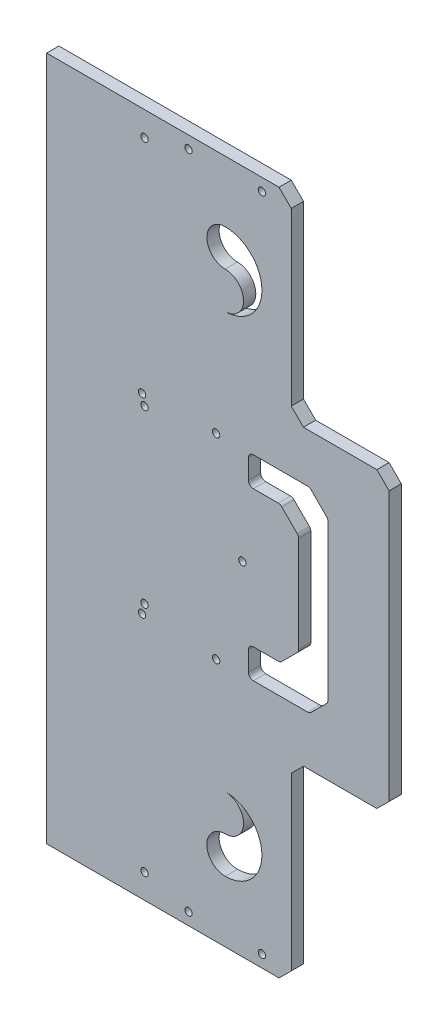
from build123d import *

# Parameters (mm, degrees)
SKETCH_1_R          = 1.5
EXTRUDE_1_DEPTH     = 5
CHAMFER_1_SIZE      = 5
SKETCH_3_R          = 1.5
CUT_EXTRUDE_2_DEPTH = 10
FILLET_1_R          = 10
FILLET_2_R          = 2
CUT_EXTRUDE_3_DEPTH = 199.053023203
EXTRUDE_2_DEPTH     = 5


with BuildPart() as part:
    # 草图1 → 凸台-拉伸1 (new body)
    with BuildSketch(Plane.XY):
        Polygon((-100, -140), (-100, -60), (-140, -60), (-140, 60), (-100, 60), (-100, 140), (100, 140), (100, 60), (140, 60), (140, -60), (100, -60), (100, -140), align=None)
        with Locations((-40, -130)):
            Circle(SKETCH_1_R, mode=Mode.SUBTRACT)
        with Locations((-40, -35)):
            Circle(SKETCH_1_R, mode=Mode.SUBTRACT)
        with Locations(Location((40, -130, 0), (0, 0, 180))):
            Circle(SKETCH_1_R, mode=Mode.SUBTRACT)
        with Locations(Location((40, -35, 0), (0, 0, 180))):
            Circle(SKETCH_1_R, mode=Mode.SUBTRACT)
        with Locations(Location((-40, 130, 0), (0, 0, 180))):
            Circle(SKETCH_1_R, mode=Mode.SUBTRACT)
        with Locations((40, 130)):
            Circle(SKETCH_1_R, mode=Mode.SUBTRACT)
        with Locations((40, 35)):
            Circle(SKETCH_1_R, mode=Mode.SUBTRACT)
        with Locations(Location((-40, 35, 0), (0, 0, 180))):
            Circle(SKETCH_1_R, mode=Mode.SUBTRACT)
        with Locations((-39, 39)):
            Circle(SKETCH_1_R, mode=Mode.SUBTRACT)
        with Locations((39, 39)):
            Circle(SKETCH_1_R, mode=Mode.SUBTRACT)
        with Locations((39, -39)):
            Circle(SKETCH_1_R, mode=Mode.SUBTRACT)
        with Locations((-39, -39)):
            Circle(SKETCH_1_R, mode=Mode.SUBTRACT)
    extrude(amount=EXTRUDE_1_DEPTH)

    # 倒角1
    chamfer_1_edges = [part.edges().sort_by_distance(p)[0] for p in [
        (-100, -140, 2.5),
        (-100, -60, 2.5),
        (-140, -60, 2.5),
        (-140, 60, 2.5),
        (-100, 60, 2.5),
        (-100, 140, 2.5),
        (100, 140, 2.5),
        (100, 60, 2.5),
        (140, 60, 2.5),
        (140, -60, 2.5),
        (100, -60, 2.5),
        (100, -140, 2.5),
    ]]
    chamfer(chamfer_1_edges, length=CHAMFER_1_SIZE)

    # 草图3 → 切除-拉伸2 (cut)
    with BuildSketch(Plane.XY.offset(5)):
        with Locations((-88, 135)):
            Circle(SKETCH_3_R)
        with Locations((-58, 135)):
            Circle(SKETCH_3_R)
        with Locations((58, 135)):
            Circle(SKETCH_3_R)
        with Locations((88, 135)):
            Circle(SKETCH_3_R)
        with Locations((88, -135)):
            Circle(SKETCH_3_R)
        with Locations((58, -135)):
            Circle(SKETCH_3_R)
        with Locations((-58, -135)):
            Circle(SKETCH_3_R)
        with Locations((-88, -135)):
            Circle(SKETCH_3_R)
        with Locations((-80, 0)):
            Circle(SKETCH_3_R)
        with Locations((-69.282032303, 40)):
            Circle(SKETCH_3_R)
        with Locations((69.282032303, 40)):
            Circle(SKETCH_3_R)
        with Locations((80, 0)):
            Circle(SKETCH_3_R)
        with Locations((69.282032303, -40)):
            Circle(SKETCH_3_R)
        with Locations((-69.282032303, -40)):
            Circle(SKETCH_3_R)
        with BuildLine():
            Line((-25, -35), (25, -35))
            ThreePointArc((25, -35), (29.393398282, -45.606601718), (40, -50))
            Line((40, -50), (40, -115))
            ThreePointArc((40, -115), (29.393398282, -119.393398282), (25, -130))
            Line((25, -130), (-25, -130))
            ThreePointArc((-25, -130), (-29.393398282, -119.393398282), (-40, -115))
            Line((-40, -115), (-40, -50))
            ThreePointArc((-40, -50), (-29.393398282, -45.606601718), (-25, -35))
        make_face()
        with BuildLine():
            Line((-25, 35), (25, 35))
            ThreePointArc((25, 35), (29.393398282, 45.606601718), (40, 50))
            Line((40, 50), (40, 115))
            ThreePointArc((40, 115), (29.393398282, 119.393398282), (25, 130))
            Line((25, 130), (-25, 130))
            ThreePointArc((-25, 130), (-29.393398282, 119.393398282), (-40, 115))
            Line((-40, 115), (-40, 50))
            ThreePointArc((-40, 50), (-29.393398282, 45.606601718), (-25, 35))
        make_face()
        Polygon((-20.071531448, -8.109425098), (-8.458486518, -19.926945474), (8.109425098, -20.071531448), (19.926945474, -8.458486518), (20.071531448, 8.109425098), (8.458486518, 19.926945474), (-8.109425098, 20.071531448), (-19.926945474, 8.458486518), align=None)
        Polygon((-107.5, 40), (-82.5, 40), (-82.5, 28), (-95.5, 28), (-103, 20.5), (-103, -20.5), (-95.5, -28), (-82.5, -28), (-82.5, -40), (-107.5, -40), (-115, -32.5), (-115, 32.5), align=None)
        Polygon((107.5, -40), (82.5, -40), (82.5, -28), (95.5, -28), (103, -20.5), (103, 20.5), (95.5, 28), (82.5, 28), (82.5, 40), (107.5, 40), (115, 32.5), (115, -32.5), align=None)
        with BuildLine():
            ThreePointArc((-73, -85), (-80.5, -92.5), (-73, -100))
            ThreePointArc((-73, -100), (-65.5, -107.5), (-73, -115))
            ThreePointArc((-73, -115), (-88, -100), (-73, -85))
        make_face()
        with BuildLine():
            ThreePointArc((-73, 85), (-88, 100), (-73, 115))
            ThreePointArc((-73, 115), (-65.5, 107.5), (-73, 100))
            ThreePointArc((-73, 100), (-80.5, 92.5), (-73, 85))
        make_face()
        with BuildLine():
            ThreePointArc((73, -85), (88, -100), (73, -115))
            ThreePointArc((73, -115), (65.5, -107.5), (73, -100))
            ThreePointArc((73, -100), (80.5, -92.5), (73, -85))
        make_face()
        with BuildLine():
            ThreePointArc((73, 85), (80.5, 92.5), (73, 100))
            ThreePointArc((73, 100), (65.5, 107.5), (73, 115))
            ThreePointArc((73, 115), (88, 100), (73, 85))
        make_face()
    extrude(amount=-CUT_EXTRUDE_2_DEPTH, mode=Mode.SUBTRACT)

    # 圆角1
    fillet_1_edges = [part.edges().sort_by_distance(p)[0] for p in [
        (-25, 35, 2.5),
        (-40, 50, 2.5),
        (-40, 115, 2.5),
        (-25, 130, 2.5),
        (25, 130, 2.5),
        (40, 115, 2.5),
        (40, 50, 2.5),
        (25, 35, 2.5),
        (-25, -130, 2.5),
        (-40, -115, 2.5),
        (-40, -50, 2.5),
        (-25, -35, 2.5),
        (25, -35, 2.5),
        (40, -50, 2.5),
        (40, -115, 2.5),
        (25, -130, 2.5),
    ]]
    fillet(fillet_1_edges, radius=FILLET_1_R)

    # 圆角2
    fillet_2_edges = [part.edges().sort_by_distance(p)[0] for p in [
        (-82.5, -40, 2.5),
        (-107.5, -40, 2.5),
        (-115, -32.5, 2.5),
        (-115, 32.5, 2.5),
        (-107.5, 40, 2.5),
        (-82.5, 40, 2.5),
        (-82.5, 28, 2.5),
        (-95.5, 28, 2.5),
        (-103, 20.5, 2.5),
        (-103, -20.5, 2.5),
        (-95.5, -28, 2.5),
        (-82.5, -28, 2.5),
        (115, -32.5, 2.5),
        (107.5, -40, 2.5),
        (82.5, -40, 2.5),
        (82.5, -28, 2.5),
        (95.5, -28, 2.5),
        (103, -20.5, 2.5),
        (103, 20.5, 2.5),
        (95.5, 28, 2.5),
        (82.5, 28, 2.5),
        (82.5, 40, 2.5),
        (107.5, 40, 2.5),
        (115, 32.5, 2.5),
    ]]
    fillet(fillet_2_edges, radius=FILLET_2_R)

    # 草图5 → 切除-拉伸3 (cut, through all)
    with BuildSketch(Plane.XY.offset(5)):
        Polygon((0, -140), (0, 140), (-95, 140), (-100, 135), (-100, 65), (-105, 60), (-135, 60), (-140, 55), (-140, -55), (-135, -60), (-105, -60), (-100, -65), (-100, -135), (-95, -140), align=None)
    extrude(amount=-CUT_EXTRUDE_3_DEPTH, mode=Mode.SUBTRACT)

    # 草图6 → 凸台-拉伸2 (add)
    with BuildSketch(Plane(origin=(0, 0, 0), x_dir=(-1, 0, 0), z_dir=(0, 0, -1))):
        with BuildLine():
            Line((0, 35), (0, 130))
            Line((0, 130), (-17.087121525, 130))
            ThreePointArc((-17.087121525, 130), (-22.5643471, 128.366600265), (-26.252272915, 124))
            ThreePointArc((-26.252272915, 124), (-29.393398282, 119.393398282), (-34, 116.252272915))
            ThreePointArc((-34, 116.252272915), (-38.366600265, 112.5643471), (-40, 107.087121525))
            Line((-40, 107.087121525), (-40, 57.912878475))
            ThreePointArc((-40, 57.912878475), (-38.366600265, 52.4356529), (-34, 48.747727085))
            ThreePointArc((-34, 48.747727085), (-29.393398282, 45.606601718), (-26.252272915, 41))
            ThreePointArc((-26.252272915, 41), (-22.5643471, 36.633399735), (-17.087121525, 35))
            Line((-17.087121525, 35), (0, 35))
        make_face()
        Polygon((0, -20.000761568), (0, 20.000761568), (-8.458486518, 19.926945474), (-20.071531448, 8.109425098), (-19.926945474, -8.458486518), (-8.109425098, -20.071531448), align=None)
        with BuildLine():
            Line((0, -130), (0, -35))
            Line((0, -35), (-17.087121525, -35))
            ThreePointArc((-17.087121525, -35), (-22.5643471, -36.633399735), (-26.252272915, -41))
            ThreePointArc((-26.252272915, -41), (-29.393398282, -45.606601718), (-34, -48.747727085))
            ThreePointArc((-34, -48.747727085), (-38.366600265, -52.4356529), (-40, -57.912878475))
            Line((-40, -57.912878475), (-40, -107.087121525))
            ThreePointArc((-40, -107.087121525), (-38.366600265, -112.5643471), (-34, -116.252272915))
            ThreePointArc((-34, -116.252272915), (-29.393398282, -119.393398282), (-26.252272915, -124))
            ThreePointArc((-26.252272915, -124), (-22.5643471, -128.366600265), (-17.087121525, -130))
            Line((-17.087121525, -130), (0, -130))
        make_face()
    extrude(amount=-EXTRUDE_2_DEPTH)


solid = part.part
